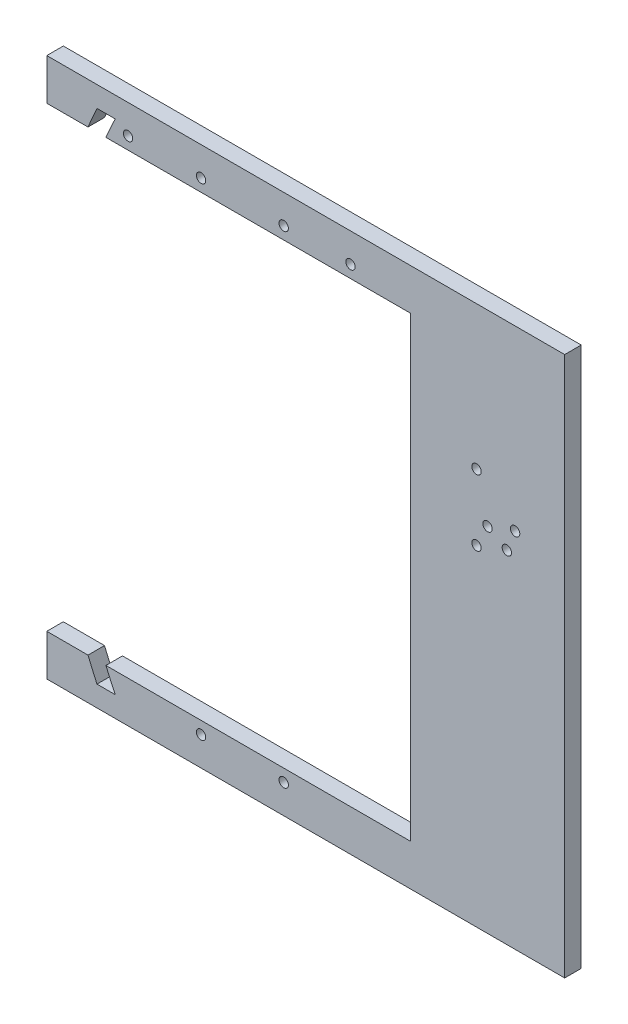
from build123d import *

# Parameters (mm, degrees)
BENCH_FRAME_EXTRUDE_DEPTH    = 3
CURVED_PANEL_CLEARANCE_DEPTH = 4
POD_FOOT_CLEARANCE_SKETCH_R  = 1.7
POD_FOOT_THROUGH_HOLES_DEPTH = 4
FOOT_COUNTERBORE_SKETCH_R    = 3.6
FOOT_COUNTERBORES_DEPTH      = 2.9


with BuildPart() as part:
    # Bench Frame Sketch → Bench Frame Extrude (new, symmetric)
    with BuildSketch(Plane.XY):
        Polygon((-70, -98), (118, -98), (118, 98), (-70, 98), (-70, 83), (62, 83), (62, -83), (-70, -83), align=None)
    extrude(amount=BENCH_FRAME_EXTRUDE_DEPTH, both=True)

    # Curved Panel Clearance Sketch → Curved Panel Clearance (cut, symmetric)
    with BuildSketch(Plane.XY):
        with BuildLine():
            Line((-51.777652934, 90.5), (-45.159619167, 90.5))
            ThreePointArc((-45.159619167, 90.5), (-65.5, 0), (-45.159619167, -90.5))
            Line((-45.159619167, -90.5), (-51.777652934, -90.5))
            ThreePointArc((-51.777652934, -90.5), (-71.5, 0), (-51.777652934, 90.5))
        make_face()
    extrude(amount=CURVED_PANEL_CLEARANCE_DEPTH, both=True, mode=Mode.SUBTRACT)

    # Pod Foot Clearance Sketch → Pod Foot Through Holes (cut, symmetric)
    with BuildSketch(Plane.XY):
        with Locations((-14, -87.5)):
            Circle(POD_FOOT_CLEARANCE_SKETCH_R)
        with Locations((16, -87.5)):
            Circle(POD_FOOT_CLEARANCE_SKETCH_R)
        with Locations((-14, 87.5)):
            Circle(POD_FOOT_CLEARANCE_SKETCH_R)
        with Locations((16, 87.5)):
            Circle(POD_FOOT_CLEARANCE_SKETCH_R)
        with Locations((40.25, 87.5)):
            Circle(POD_FOOT_CLEARANCE_SKETCH_R)
        with Locations((-40.5, 87.5)):
            Circle(POD_FOOT_CLEARANCE_SKETCH_R)
        with Locations((86, 22)):
            Circle(POD_FOOT_CLEARANCE_SKETCH_R)
        with Locations((86, 46)):
            Circle(POD_FOOT_CLEARANCE_SKETCH_R)
        with Locations((90, 30)):
            Circle(POD_FOOT_CLEARANCE_SKETCH_R)
        with Locations((97, 26)):
            Circle(POD_FOOT_CLEARANCE_SKETCH_R)
        with Locations((100, 33.5)):
            Circle(POD_FOOT_CLEARANCE_SKETCH_R)
    extrude(amount=POD_FOOT_THROUGH_HOLES_DEPTH, both=True, mode=Mode.SUBTRACT)

    # Foot Counterbore Sketch → Foot Counterbores (cut)
    with BuildSketch(Plane.XY.offset(-3)):
        with Locations((-14, -87.5)):
            Circle(FOOT_COUNTERBORE_SKETCH_R)
        with Locations((16, -87.5)):
            Circle(FOOT_COUNTERBORE_SKETCH_R)
        with Locations((-14, 87.5)):
            Circle(FOOT_COUNTERBORE_SKETCH_R)
        with Locations((16, 87.5)):
            Circle(FOOT_COUNTERBORE_SKETCH_R)
        with Locations((40.25, 87.5)):
            Circle(FOOT_COUNTERBORE_SKETCH_R)
        with Locations((-40.5, 87.5)):
            Circle(FOOT_COUNTERBORE_SKETCH_R)
        with Locations((86, 22)):
            Circle(FOOT_COUNTERBORE_SKETCH_R)
        with Locations((86, 46)):
            Circle(FOOT_COUNTERBORE_SKETCH_R)
        with Locations((90, 30)):
            Circle(FOOT_COUNTERBORE_SKETCH_R)
        with Locations((97, 26)):
            Circle(FOOT_COUNTERBORE_SKETCH_R)
        with Locations((100, 33.5)):
            Circle(FOOT_COUNTERBORE_SKETCH_R)
    extrude(amount=FOOT_COUNTERBORES_DEPTH, mode=Mode.SUBTRACT)


solid = part.part
